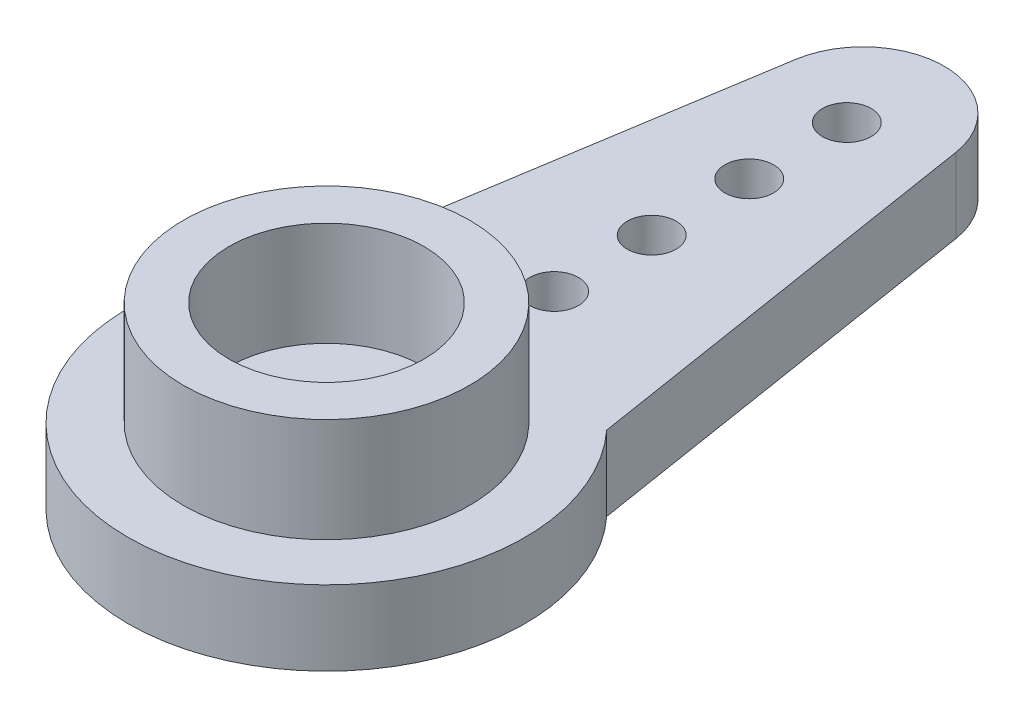
from build123d import *

# Parameters (mm, degrees)
SKETCH1_R           = 6.1
SKETCH1_R_2         = 1.5
BOSS_EXTRUDE1_DEPTH = 2.3
SKETCH2_R           = 4.4
SKETCH2_R_2         = 3
BOSS_EXTRUDE2_DEPTH = 3.2
BOSS_EXTRUDE3_DEPTH = 2.3


with BuildPart() as part:
    # Sketch1 → Boss-Extrude1 (new body)
    with BuildSketch(Plane(origin=(0, 0, 0), x_dir=(1, 0, 0), z_dir=(0, 1, 0))):
        with Locations(Location((0, 0, 0), (0, 0, 270))):
            Circle(SKETCH1_R)
        with Locations(Location((0, 0, 0), (0, 0, 270))):
            Circle(SKETCH1_R_2, mode=Mode.SUBTRACT)
    extrude(amount=BOSS_EXTRUDE1_DEPTH)

    # Sketch2 → Boss-Extrude2 (add)
    with BuildSketch(Plane(origin=(0, 2.3, 0), x_dir=(1, 0, 0), z_dir=(0, 1, 0))):
        with Locations(Location((0, 0, 0), (0, 0, 270))):
            Circle(SKETCH2_R)
        with Locations(Location((0, 0, 0), (0, 0, 270))):
            Circle(SKETCH2_R_2, mode=Mode.SUBTRACT)
    extrude(amount=BOSS_EXTRUDE2_DEPTH)

    # Sketch3 → Boss-Extrude3 (add)
    with BuildSketch(Plane.XZ):
        with BuildLine():
            ThreePointArc((4.5, -4.118252056), (2.458522163, -5.582622034), (0, -6.1))
            Line((0, -6.1), (0, -6.25))
            ThreePointArc((0, -6.25), (0.530330086, -6.469669914), (0.75, -7))
            ThreePointArc((0.75, -7), (0.530330086, -7.530330086), (0, -7.75))
            Line((0, -7.75), (0, -9.25))
            ThreePointArc((0, -9.25), (0.530330086, -9.469669914), (0.75, -10))
            ThreePointArc((0.75, -10), (0.530330086, -10.530330086), (0, -10.75))
            Line((0, -10.75), (0, -12.25))
            ThreePointArc((0, -12.25), (0.530330086, -12.469669914), (0.75, -13))
            ThreePointArc((0.75, -13), (0.530330086, -13.530330086), (0, -13.75))
            Line((0, -13.75), (0, -15.25))
            ThreePointArc((0, -15.25), (0.530330086, -15.469669914), (0.75, -16))
            ThreePointArc((0.75, -16), (0.530330086, -16.530330086), (0, -16.75))
            Line((0, -16.75), (0, -19))
            ThreePointArc((0, -19), (1.623056726, -18.401495955), (2.468988638, -16.892549493))
            Line((2.468988638, -16.892549493), (4.5, -4.118252056))
        make_face()
        with BuildLine():
            Line((0, -6.25), (0, -6.1))
            ThreePointArc((0, -6.1), (-2.458522163, -5.582622034), (-4.5, -4.118252056))
            Line((-4.5, -4.118252056), (-2.468988638, -16.892549493))
            ThreePointArc((-2.468988638, -16.892549493), (-1.623056726, -18.401495955), (0, -19))
            Line((0, -19), (0, -16.75))
            ThreePointArc((0, -16.75), (-0.75, -16), (0, -15.25))
            Line((0, -15.25), (0, -13.75))
            ThreePointArc((0, -13.75), (-0.75, -13), (0, -12.25))
            Line((0, -12.25), (0, -10.75))
            ThreePointArc((0, -10.75), (-0.75, -10), (0, -9.25))
            Line((0, -9.25), (0, -7.75))
            ThreePointArc((0, -7.75), (-0.75, -7), (0, -6.25))
        make_face()
    extrude(amount=-BOSS_EXTRUDE3_DEPTH)


solid = part.part
